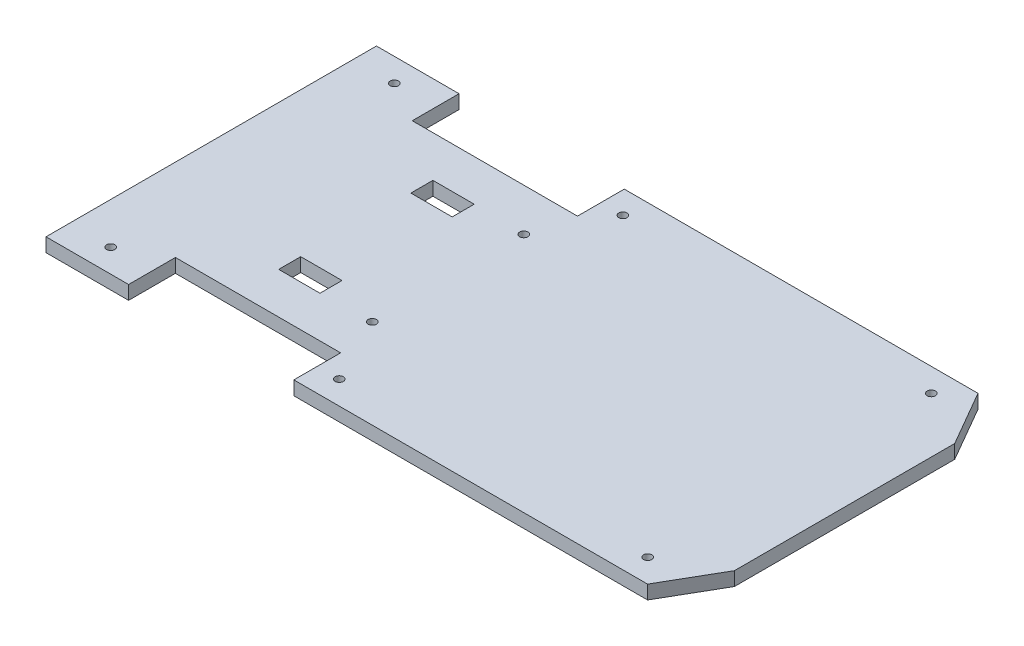
from build123d import *

# Parameters (mm, degrees)
ESQUISSE1_R        = 1.5
ESQUISSE1_W        = 15
ESQUISSE1_H        = 8
BOSS_EXTRU_1_DEPTH = 5


with BuildPart() as part:
    # Esquisse1 → Boss.-Extru.1 (new body)
    with BuildSketch(Plane(origin=(0, 0, 0), x_dir=(1, 0, 0), z_dir=(0, 1, 0))):
        Polygon((103.452994616, 60), (115, 40), (115, 0), (-115, 0), (-115, 60), (-85, 60), (-85, 43), (-25, 43), (-25, 60), align=None)
        with Locations(Location((-100, 51.5, 0), (0, 0, 270))):
            Circle(ESQUISSE1_R, mode=Mode.SUBTRACT)
        with Locations(Location((-17, 51.5, 0), (0, 0, 270))):
            Circle(ESQUISSE1_R, mode=Mode.SUBTRACT)
        with Locations(Location((95, 51.5, 0), (0, 0, 270))):
            Circle(ESQUISSE1_R, mode=Mode.SUBTRACT)
        with Locations(Location((-29, 27.5, 0), (0, 0, 270))):
            Circle(ESQUISSE1_R, mode=Mode.SUBTRACT)
        with Locations((-55, 24)):
            Rectangle(ESQUISSE1_W, ESQUISSE1_H, mode=Mode.SUBTRACT)
    boss_extru_1 = extrude(amount=BOSS_EXTRU_1_DEPTH)

    # Symétrie1: Boss.-Extru.1 across plane
    add(boss_extru_1.mirror(Plane(origin=(-115, 5, 0), x_dir=(1, 0, 0), z_dir=(0, 0, -1))))


solid = part.part
